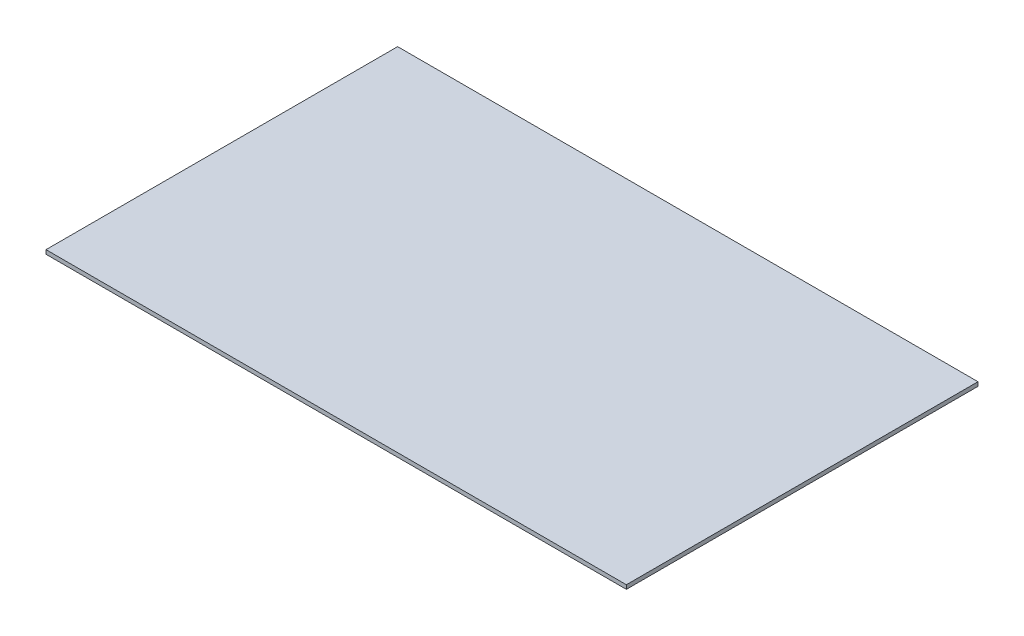
from build123d import *

# Parameters (mm, degrees)
SKETCH2_W           = 458
SKETCH2_H           = 3.175
BOSS_EXTRUDE1_DEPTH = 277.48


with BuildPart() as part:
    # Sketch2 → Boss-Extrude1 (new body)
    with BuildSketch(Plane.XY):
        with Locations((229, 1.5875)):
            Rectangle(SKETCH2_W, SKETCH2_H)
    extrude(amount=BOSS_EXTRUDE1_DEPTH)


solid = part.part
